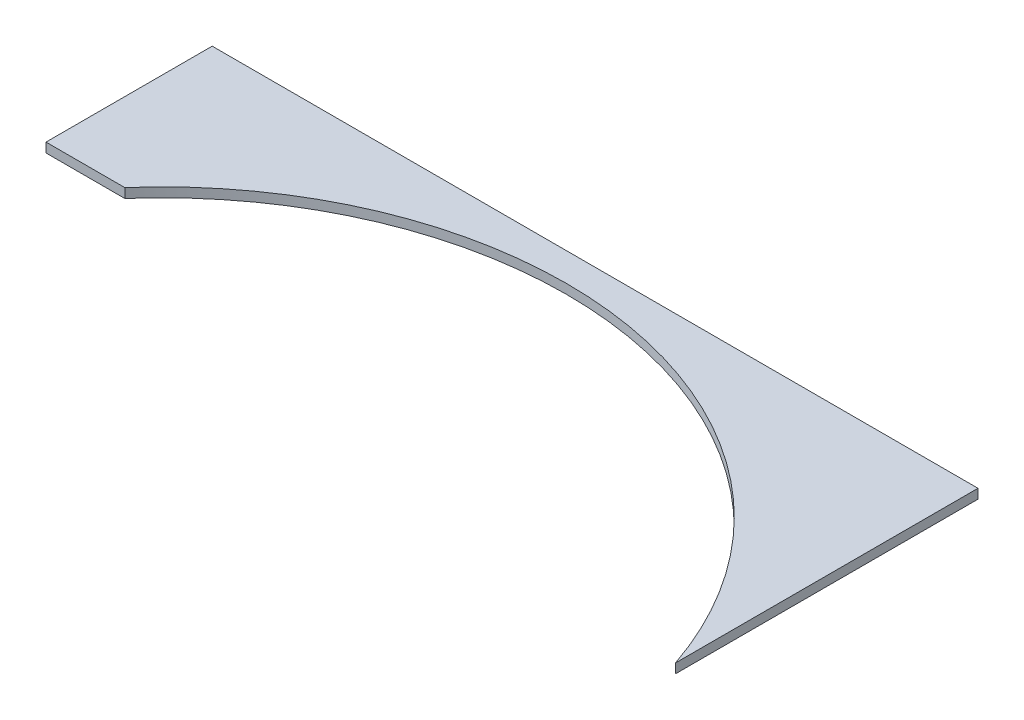
from build123d import *

# Parameters (mm, degrees)
BOSS_EXTRUDE1_DEPTH = 6.35
CUT_EXTRUDE1_DEPTH  = 328.825476626


with BuildPart() as part:
    # Sketch1 → Boss-Extrude1 (new body)
    with BuildSketch(Plane(origin=(0, 0, 0), x_dir=(1, 0, 0), z_dir=(0, 1, 0))):
        with BuildLine():
            Line((257.175, 0), (-257.175, 0))
            Line((-257.175, 0), (-257.175, -203.2))
            ThreePointArc((-257.175, -203.2), (-158.153567084, -69.834458038), (0, -19.05))
            ThreePointArc((0, -19.05), (158.153567084, -69.834458038), (257.175, -203.2))
            Line((257.175, -203.2), (257.175, 0))
        make_face()
    extrude(amount=BOSS_EXTRUDE1_DEPTH)

    # Sketch2 → Cut-Extrude1 (cut, through all)
    with BuildSketch(Plane(origin=(0, 6.35, 0), x_dir=(1, 0, 0), z_dir=(0, 1, 0))):
        with BuildLine():
            Line((-257.175, -111.6203), (-204.266839371, -111.6203))
            ThreePointArc((-204.266839371, -111.6203), (-235.22086035, -154.810408098), (-257.175, -203.2))
            Line((-257.175, -203.2), (-257.175, -111.6203))
        make_face()
    extrude(amount=-CUT_EXTRUDE1_DEPTH, mode=Mode.SUBTRACT)


solid = part.part
